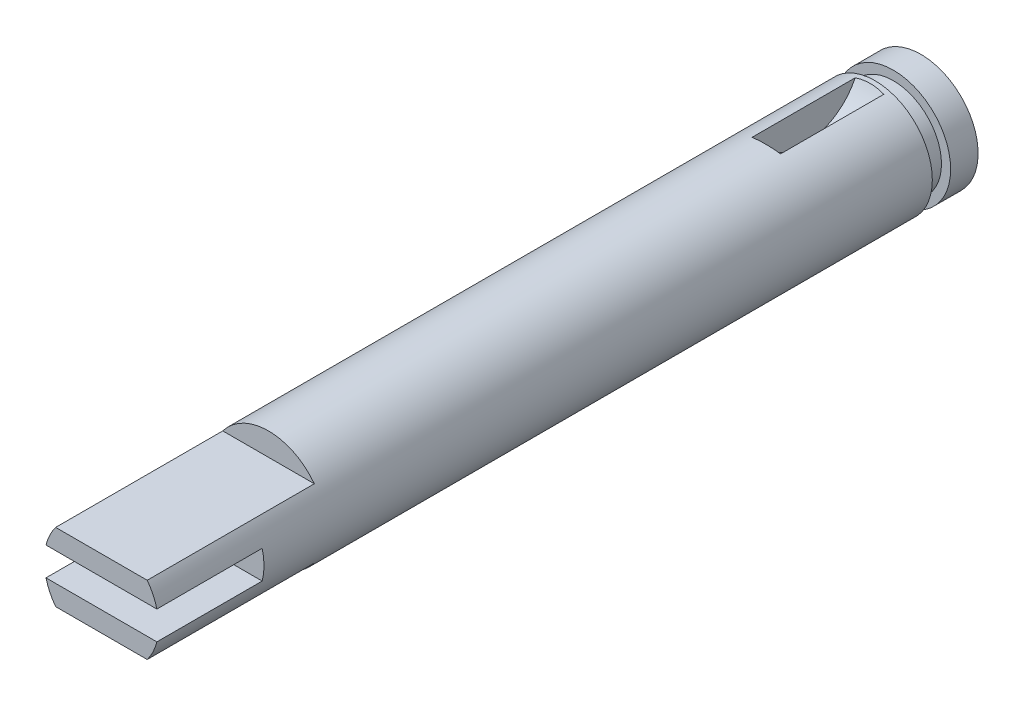
from build123d import *

# Parameters (mm, degrees)
SKETCH1_R           = 3.175
EXTRUDE1_DEPTH      = 42.926
EXTRUDE2_DEPTH      = 0.79375
EXTRUDE2_DEPTH_BACK = 0.79375
SKETCH4_R           = 3.175
EXTRUDE3_START      = 2.54
SKETCH5_R           = 3.175
EXTRUDE3_DEPTH      = 2.54
SKETCH6_OUTSIDE_W   = 17.618
SKETCH6_OUTSIDE_H   = 17.618
SKETCH6_OUTSIDE_R   = 2.667
EXTRUDE4_DEPTH      = 1.016
EXTRUDE5_DEPTH      = 44.160198515
EXTRUDE5_DEPTH_BACK = 44.160198515
EXTRUDE6_DEPTH      = 44.160198515


with BuildPart() as part:
    # Sketch1 → Extrude1 (new body)
    with BuildSketch(Plane.XY):
        Circle(SKETCH1_R)
    extrude(amount=EXTRUDE1_DEPTH)

    # Sketch4 → Extrude2 (cut, two sides: drawn at the far end of the back side and taken through both)
    with BuildSketch(Plane(origin=(0, 0, 0), x_dir=(0, 0, -1), z_dir=(1, 0, 0)).offset(-EXTRUDE2_DEPTH_BACK)):
        with Locations((-3.175, 4.445)):
            Circle(SKETCH4_R)
    extrude(amount=EXTRUDE2_DEPTH + EXTRUDE2_DEPTH_BACK, mode=Mode.SUBTRACT)

    # Sketch5 → Extrude3 (add)
    with BuildSketch(Plane(origin=(0, 0, 0), x_dir=(-1, 0, 0), z_dir=(0, 0, -1)).offset(EXTRUDE3_START)):
        Circle(SKETCH5_R)
    extrude(amount=-EXTRUDE3_DEPTH)

    # Sketch6 outside → Extrude4 (cut)
    with BuildSketch(Plane.XY):
        Rectangle(SKETCH6_OUTSIDE_W, SKETCH6_OUTSIDE_H)
        Circle(SKETCH6_OUTSIDE_R, mode=Mode.SUBTRACT)
    extrude(amount=-EXTRUDE4_DEPTH, mode=Mode.SUBTRACT)

    # Sketch7 → Extrude5 (cut, two sides: drawn at the far end of the back side and taken through both)
    with BuildSketch(Plane(origin=(0, 0, 0), x_dir=(0, 0, -1), z_dir=(1, 0, 0)).offset(-EXTRUDE5_DEPTH_BACK)):
        Polygon((-42.926, 0), (-42.926, 0.7874), (-37.084, 0.7874), (-37.084, 0), (-37.084, -0.7874), (-42.926, -0.7874), align=None)
    extrude(amount=EXTRUDE5_DEPTH + EXTRUDE5_DEPTH_BACK, mode=Mode.SUBTRACT)

    # Sketch8 → Extrude6 (cut, symmetric)
    with BuildSketch(Plane(origin=(0, 0, 0), x_dir=(0, 0, -1), z_dir=(1, 0, 0))):
        Polygon((-42.926, 1.905), (-40.005, 1.905), (-33.655, 1.905), (-33.655, 3.175), (-42.926, 3.175), align=None)
    extrude6 = extrude(amount=EXTRUDE6_DEPTH, both=True, mode=Mode.SUBTRACT)

    # Mirror1: Extrude6 across plane
    add(extrude6.mirror(Plane.ZX), mode=Mode.SUBTRACT)


solid = part.part
